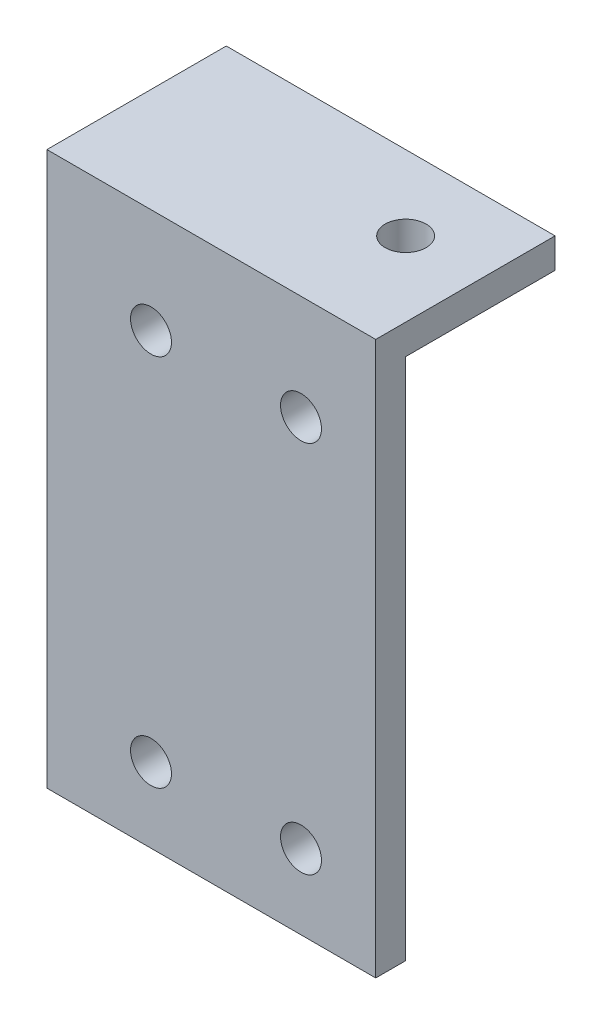
from build123d import *

# Parameters (mm, degrees)
SKETCH1_W           = 40
SKETCH1_H           = 70
SKETCH1_R           = 2.74
BOSS_EXTRUDE1_DEPTH = 4
SKETCH2_W           = 40
SKETCH2_H           = 24
SKETCH2_R           = 2.74
BOSS_EXTRUDE2_DEPTH = 4
SKETCH3_W           = 24
SKETCH3_H           = 74
SKETCH3_R           = 2.74
BOSS_EXTRUDE3_DEPTH = 4


with BuildPart() as part:
    # Sketch1 → Boss-Extrude1 (new body)
    with BuildSketch(Plane.XY):
        with Locations((-209.068179547, -486.277483232)):
            Rectangle(SKETCH1_W, SKETCH1_H)
        with Locations((-199.068179547, -461.277483232)):
            Circle(SKETCH1_R, mode=Mode.SUBTRACT)
        with Locations((-219.139101533, -461.277483232)):
            Circle(SKETCH1_R, mode=Mode.SUBTRACT)
        with Locations((-219.139101533, -511.277483232)):
            Circle(SKETCH1_R, mode=Mode.SUBTRACT)
        with Locations((-199.068179547, -511.277483232)):
            Circle(SKETCH1_R, mode=Mode.SUBTRACT)
    extrude(amount=BOSS_EXTRUDE1_DEPTH)

    # Sketch2 → Boss-Extrude2 (add)
    with BuildSketch(Plane(origin=(0, -451.277483232, 0), x_dir=(1, 0, 0), z_dir=(0, 1, 0))):
        with Locations((-209.068179547, 8)):
            Rectangle(SKETCH2_W, SKETCH2_H)
        with Locations(Location((-199.068179547, 10, 0), (0, 0, 270))):
            Circle(SKETCH2_R, mode=Mode.SUBTRACT)
    extrude(amount=BOSS_EXTRUDE2_DEPTH)

    # Sketch3 → Boss-Extrude3 (add)
    with BuildSketch(Plane.ZY.offset(229.068179547)):
        with Locations((-8, -484.277483232)):
            Rectangle(SKETCH3_W, SKETCH3_H)
        with Locations(Location((-10, -461.277483232, 0), (0, 0, 270))):
            Circle(SKETCH3_R, mode=Mode.SUBTRACT)
        with Locations(Location((-10, -511.277483232, 0), (0, 0, 270))):
            Circle(SKETCH3_R, mode=Mode.SUBTRACT)
    extrude(amount=BOSS_EXTRUDE3_DEPTH)


solid = part.part
